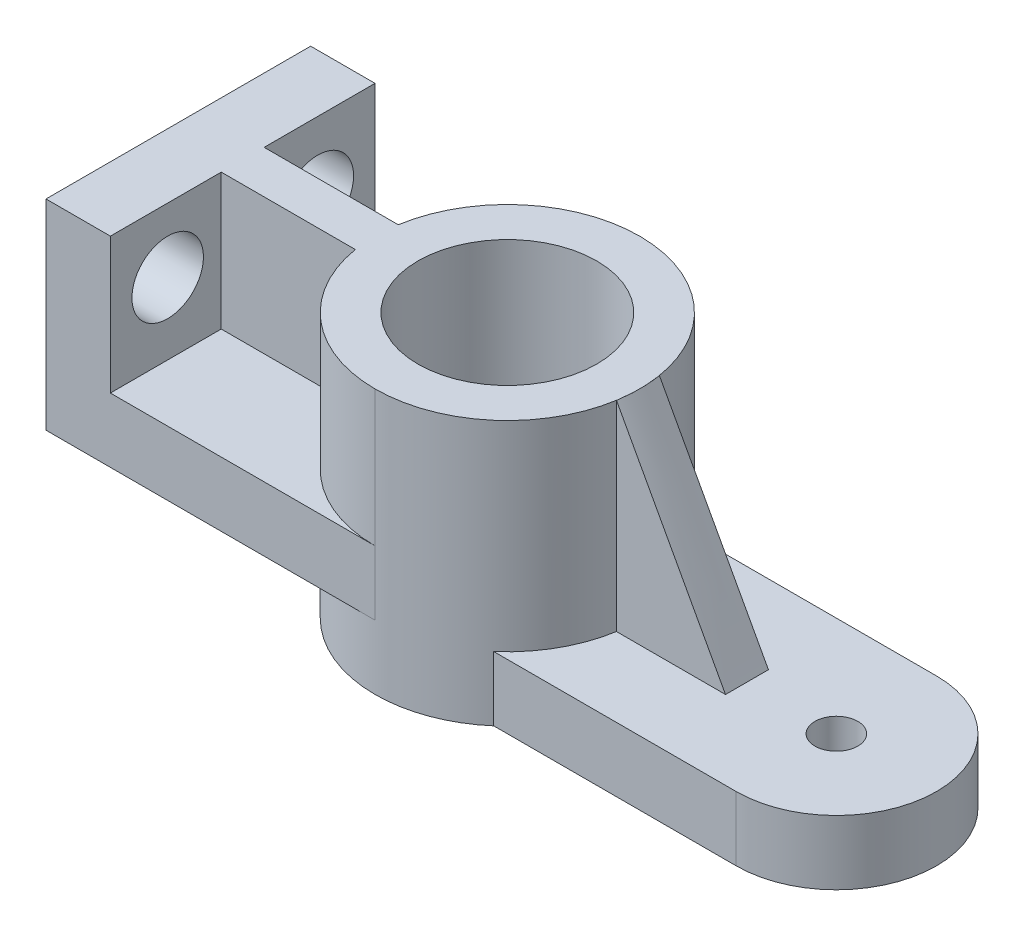
from build123d import *

# Parameters (mm, degrees)
SKETCH1_W                  = 9
SKETCH1_H                  = 37
BOSS_EXTRUDE1_DEPTH        = 28
BOSS_EXTRUDE2_DEPTH        = 9
BOSS_EXTRUDE3_DEPTH        = 28
BOSS_EXTRUDE3_DEPTH_BACK   = 9
SKETCH1_4_R                = 18.5
SKETCH1_4_R_2              = 12.5
BOSS_EXTRUDE4_START        = -9
SKETCH1_5_R                = 3
BOSS_EXTRUDE4_DEPTH        = 9
F_10_0MM_DOWEL_HOLE1_D     = 10
F_10_0MM_DOWEL_HOLE1_DEPTH = 9


with BuildPart() as part:
    # Sketch1 → Boss-Extrude1 (new body)
    with BuildSketch(Plane(origin=(0, 0, 0), x_dir=(1, 0, 0), z_dir=(0, 1, 0))):
        with Locations((-41.5, 0)):
            Rectangle(SKETCH1_W, SKETCH1_H)
        with BuildLine():
            Line((-18.255136264, 3), (-37, 3))
            Line((-37, 3), (-37, -3))
            Line((-37, -3), (-18.255136264, -3))
            ThreePointArc((-18.255136264, -3), (-18.5, 0), (-18.255136264, 3))
        make_face()
    extrude(amount=BOSS_EXTRUDE1_DEPTH)

    # Sketch1<3> → Boss-Extrude2 (add)
    with BuildSketch(Plane(origin=(0, 0, 0), x_dir=(1, 0, 0), z_dir=(0, 1, 0))):
        with BuildLine():
            Line((-37, -3), (-37, -18.5))
            Line((-37, -18.5), (0, -18.5))
            ThreePointArc((0, -18.5), (-11.973930015, -14.102304776), (-18.255136264, -3))
            Line((-18.255136264, -3), (-37, -3))
        make_face()
        with BuildLine():
            Line((0, 18.5), (-37, 18.5))
            Line((-37, 18.5), (-37, 3))
            Line((-37, 3), (-18.255136264, 3))
            ThreePointArc((-18.255136264, 3), (-11.973930015, 14.102304776), (0, 18.5))
        make_face()
    extrude(amount=BOSS_EXTRUDE2_DEPTH)

    # Sketch1<4> → Boss-Extrude3 (add, two sides: drawn at the far end of the back side and taken through both)
    with BuildSketch(Plane(origin=(0, 0, 0), x_dir=(1, 0, 0), z_dir=(0, 1, 0)).offset(-BOSS_EXTRUDE3_DEPTH_BACK)):
        with Locations(Location((0, 0, 0), (0, 0, 270))):
            Circle(SKETCH1_4_R)
        with Locations(Location((0, 0, 0), (0, 0, 270))):
            Circle(SKETCH1_4_R_2, mode=Mode.SUBTRACT)
    extrude(amount=BOSS_EXTRUDE3_DEPTH + BOSS_EXTRUDE3_DEPTH_BACK)

    # Sketch1<5> → Boss-Extrude4 (add)
    with BuildSketch(Plane(origin=(0, 0, 0), x_dir=(1, 0, 0), z_dir=(0, 1, 0)).offset(BOSS_EXTRUDE4_START)):
        with BuildLine():
            Line((46, 14), (12.093386622, 14))
            ThreePointArc((12.093386622, 14), (16.822271733, 7.698127938), (18.5, 0))
            ThreePointArc((18.5, 0), (16.822271733, -7.698127938), (12.093386622, -14))
            Line((12.093386622, -14), (46, -14))
            ThreePointArc((46, -14), (60, 0), (46, 14))
        make_face()
        with Locations(Location((46, 0, 0), (0, 0, 270))):
            Circle(SKETCH1_5_R, mode=Mode.SUBTRACT)
    extrude(amount=BOSS_EXTRUDE4_DEPTH)

    # Ø10.0mm Dowel Hole1
    with Locations(Plane(origin=(-37, 19, 10.48887685), x_dir=(0, 0, 1), z_dir=(1, 0, 0))):
        with Locations((0, 0), (-20.98887685, 0.683409513)):
            Hole(F_10_0MM_DOWEL_HOLE1_D / 2, depth=F_10_0MM_DOWEL_HOLE1_DEPTH)


solid = part.part
